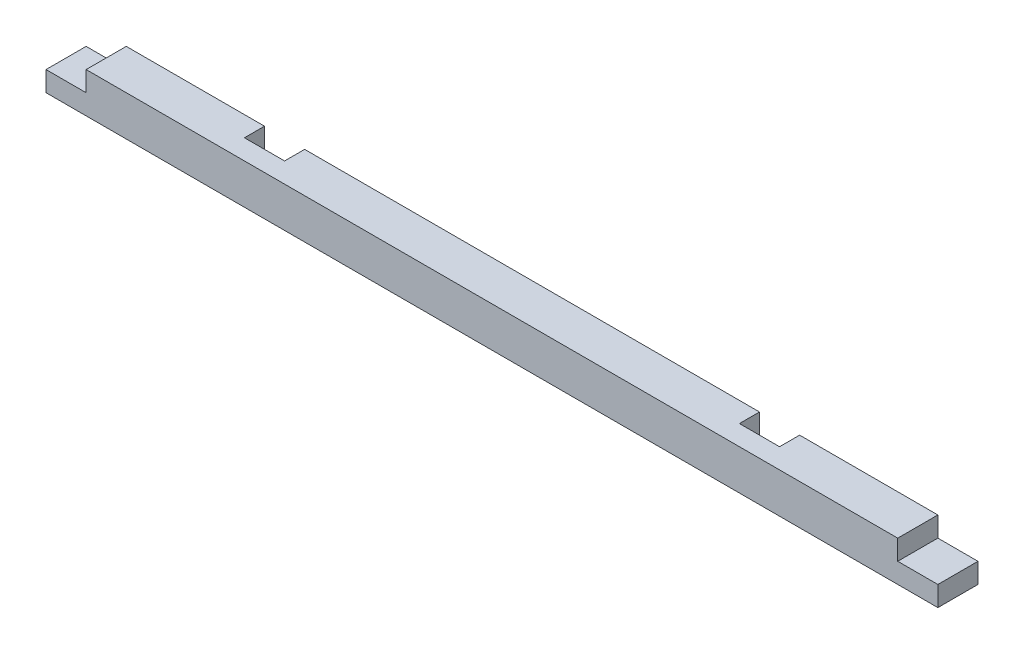
from build123d import *

# Parameters (mm, degrees)
SKETCH1_W           = 90
SKETCH1_H           = 90
BOSS_EXTRUDE1_DEPTH = 2000
SKETCH2_W           = 90
SKETCH2_H           = 90
CUT_EXTRUDE1_DEPTH  = 45
SKETCH3_W           = 90
SKETCH3_H           = 90
CUT_EXTRUDE2_DEPTH  = 45


with BuildPart() as part:
    # Sketch1 → Boss-Extrude1 (new body)
    with BuildSketch(Plane(origin=(0, 0, 0), x_dir=(0, 0, -1), z_dir=(1, 0, 0))):
        with Locations((45, 45)):
            Rectangle(SKETCH1_W, SKETCH1_H)
    extrude(amount=BOSS_EXTRUDE1_DEPTH)

    # Sketch2 → Cut-Extrude1 (cut)
    with BuildSketch(Plane(origin=(0, 90, 0), x_dir=(1, 0, 0), z_dir=(0, 1, 0))):
        with Locations((45, 45)):
            Rectangle(SKETCH2_W, SKETCH2_H)
        with Locations((1955, 45)):
            Rectangle(SKETCH2_W, SKETCH2_H)
    extrude(amount=-CUT_EXTRUDE1_DEPTH, mode=Mode.SUBTRACT)

    # Sketch3 → Cut-Extrude2 (cut)
    with BuildSketch(Plane(origin=(0, 0, -90), x_dir=(-1, 0, 0), z_dir=(0, 0, -1))):
        with Locations((-1555, 45)):
            Rectangle(SKETCH3_W, SKETCH3_H)
        with Locations((-445, 45)):
            Rectangle(SKETCH3_W, SKETCH3_H)
    extrude(amount=-CUT_EXTRUDE2_DEPTH, mode=Mode.SUBTRACT)


solid = part.part
